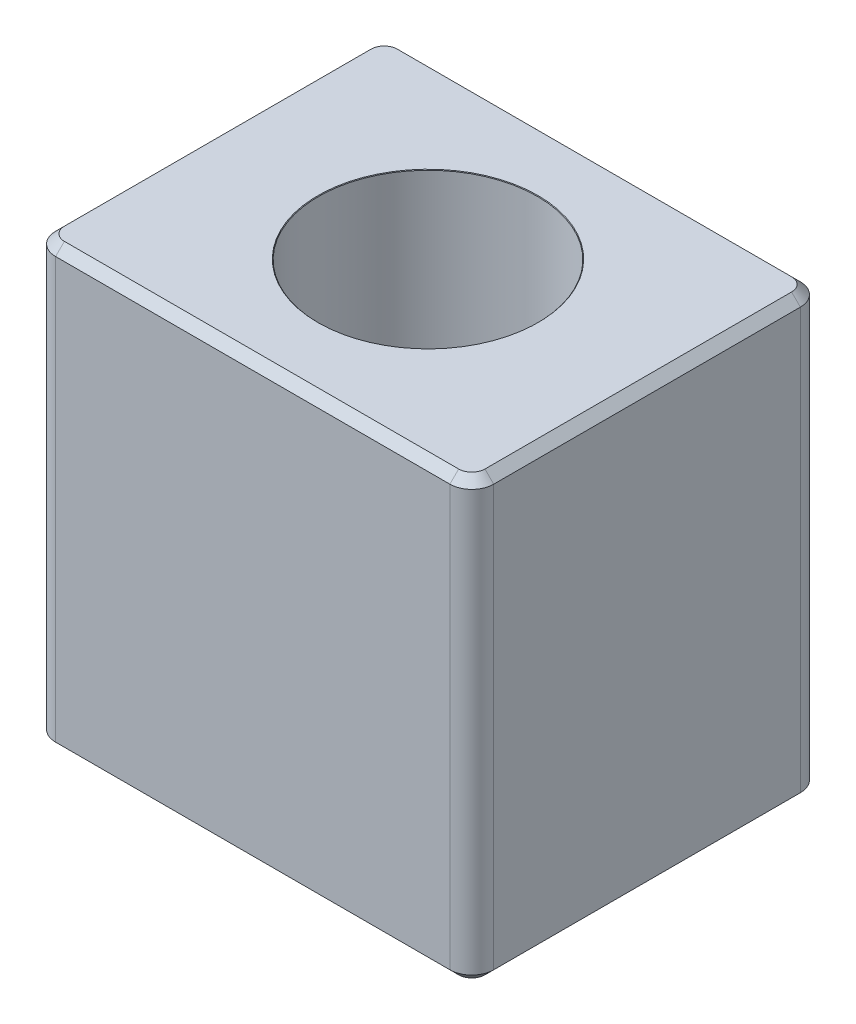
from build123d import *

# Parameters (mm, degrees)
SKETCH1_W           = 20
SKETCH1_H           = 20
BOSS_EXTRUDE1_DEPTH = 16
FILLET1_R           = 1
CHAMFER1_SIZE       = 0.4


with BuildPart() as part:
    # Sketch1 → Boss-Extrude1 (new body)
    with BuildSketch(Plane.XY):
        Rectangle(SKETCH1_W, SKETCH1_H)
    extrude(amount=BOSS_EXTRUDE1_DEPTH)

    # Sketch4 → CBORE for M5 Hex Socket Head Cap Screw1 (revolve, cut)
    with BuildSketch(Plane(origin=(0, 10, 8), x_dir=(0, 0, 1), z_dir=(1, 0, 0))):
        Polygon((0, 0), (0, 20), (2.75, 20), (2.75, 11), (5, 11), (5, 0.025), (5.025, 0), align=None)
    revolve(axis=Axis((0, 16.35, 8), (0, -1, 0)), mode=Mode.SUBTRACT)

    # Fillet1
    fillet1_edges = [part.edges().sort_by_distance(p)[0] for p in [
        (10, 0, 16),
        (-10, 0, 16),
        (10, 0, 0),
        (-10, 0, 0),
    ]]
    fillet(fillet1_edges, radius=FILLET1_R)

    # Chamfer1
    chamfer1_edges = [part.edges().sort_by_distance(p)[0] for p in [
        (10, 10, 8),
        (10, -10, 8),
        (0, 10, 0),
        (-10, 10, 8),
        (0, 10, 16),
        (-9.707106781, 10, 15.707106781),
        (-9.707106781, 10, 0.292893219),
        (9.707106781, 10, 15.707106781),
        (9.707106781, 10, 0.292893219),
        (0, -10, 0),
        (0, -10, 16),
        (-10, -10, 8),
        (-9.707106781, -10, 15.707106781),
        (-9.707106781, -10, 0.292893219),
        (9.707106781, -10, 15.707106781),
        (9.707106781, -10, 0.292893219),
    ]]
    chamfer(chamfer1_edges, length=CHAMFER1_SIZE)


solid = part.part
